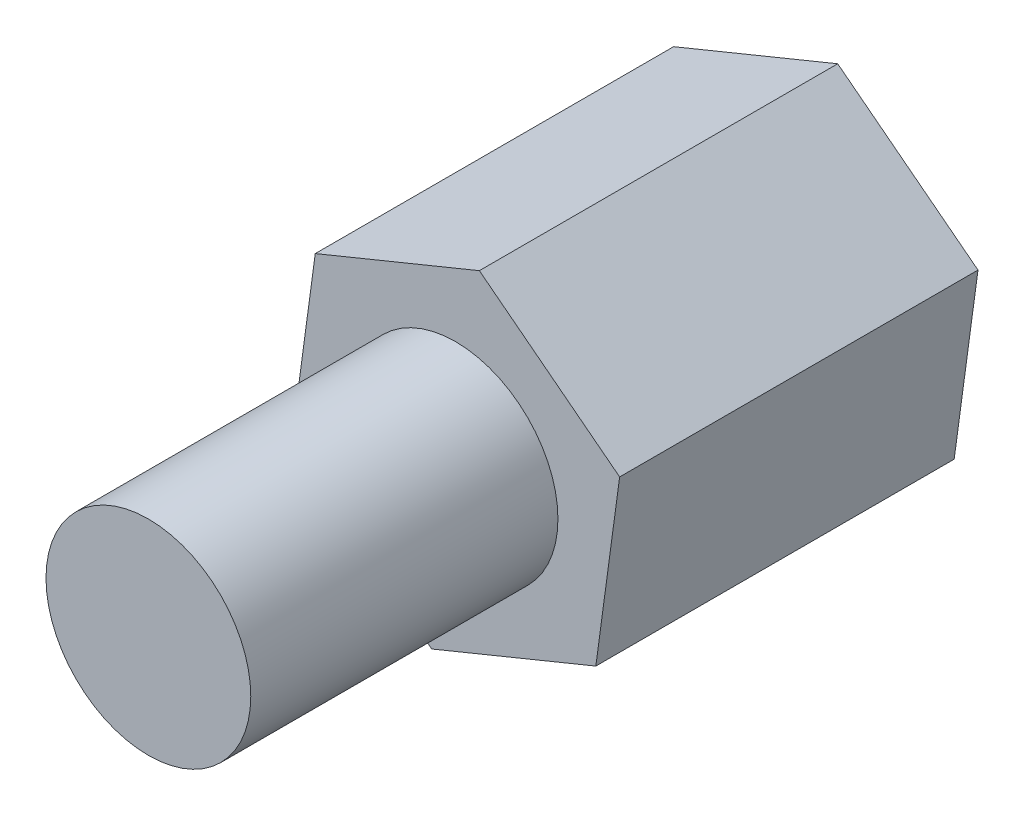
from build123d import *

# Parameters (mm, degrees)
EXTRUDE_1_DEPTH     = 7
SKETCH_2_R          = 2
EXTRUDE_2_DEPTH     = 6
SKETCH_3_R          = 2
CUT_EXTRUDE_1_DEPTH = 4


with BuildPart() as part:
    # 草图1 → 凸台-拉伸1 (new body)
    with BuildSketch(Plane.XY):
        Polygon((2.740200821, -2.119268615), (3.205440868, 1.313449215), (0.465240048, 3.43271783), (-2.740200821, 2.119268615), (-3.205440868, -1.313449215), (-0.465240048, -3.43271783), align=None)
    extrude(amount=EXTRUDE_1_DEPTH)

    # 草图2 → 凸台-拉伸2 (add)
    with BuildSketch(Plane.XY.offset(7)):
        Circle(SKETCH_2_R)
    extrude(amount=EXTRUDE_2_DEPTH)

    # 草图3 → 切除-拉伸1 (cut)
    with BuildSketch(Plane(origin=(0, 0, 0), x_dir=(-1, 0, 0), z_dir=(0, 0, -1))):
        with Locations(Location((0, 0, 0), (0, 0, 180))):
            Circle(SKETCH_3_R)
    extrude(amount=-CUT_EXTRUDE_1_DEPTH, mode=Mode.SUBTRACT)


solid = part.part
